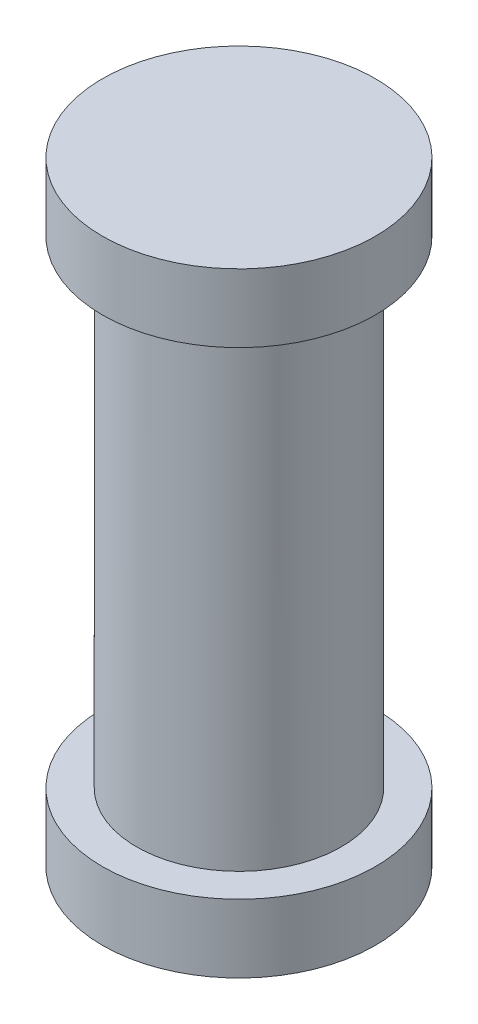
from build123d import *

# Parameters (mm, degrees)
SKETCH1_R           = 3
BOSS_EXTRUDE1_DEPTH = 7
SKETCH2_R           = 4
BOSS_EXTRUDE2_DEPTH = 2


with BuildPart() as part:
    # Sketch1 → Boss-Extrude1 (new, symmetric)
    with BuildSketch(Plane(origin=(0, 0, 0), x_dir=(1, 0, 0), z_dir=(0, 1, 0))):
        with Locations(Location((0, 0, 0), (0, 0, 270))):
            Circle(SKETCH1_R)
    extrude(amount=BOSS_EXTRUDE1_DEPTH, both=True)

    # Sketch2 → Boss-Extrude2 (add)
    with BuildSketch(Plane(origin=(0, 7, 0), x_dir=(1, 0, 0), z_dir=(0, 1, 0))):
        with Locations(Location((0, 0, 0), (0, 0, 270))):
            Circle(SKETCH2_R)
    boss_extrude2 = extrude(amount=BOSS_EXTRUDE2_DEPTH)

    # Mirror1: Boss-Extrude2 across plane
    add(boss_extrude2.mirror(Plane.ZX))


solid = part.part
